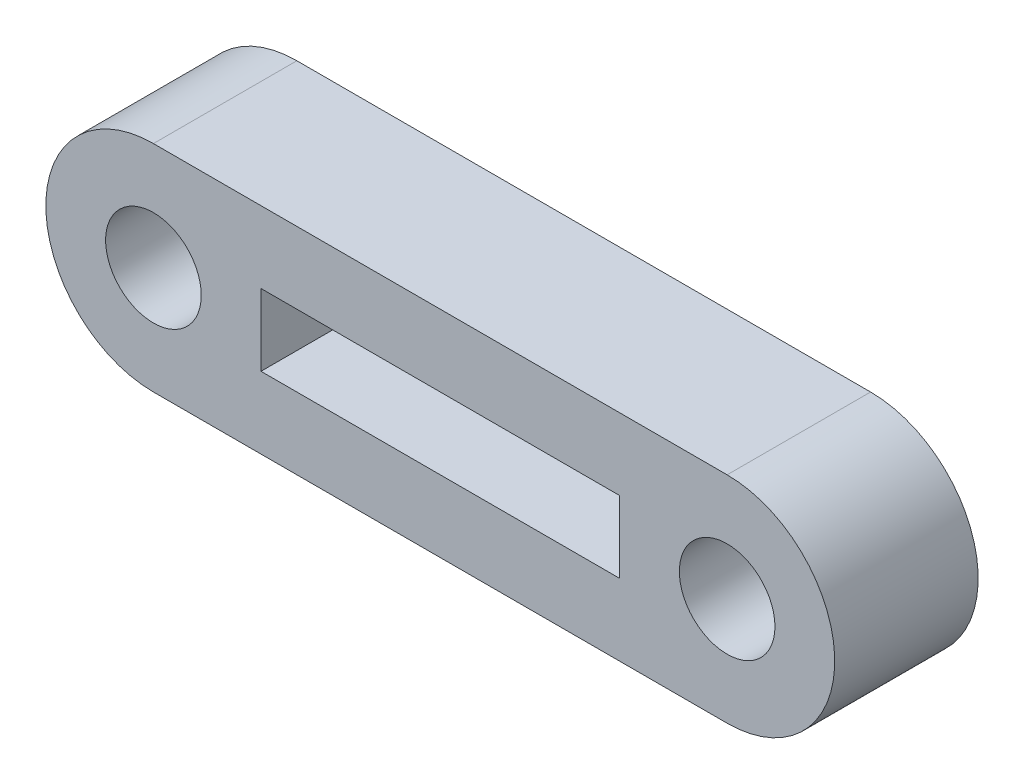
from build123d import *

# Parameters (mm, degrees)
SKETCH1_R           = 2
SKETCH1_W           = 15
SKETCH1_H           = 3
BOSS_EXTRUDE1_DEPTH = 6


with BuildPart() as part:
    # Sketch1 → Boss-Extrude1 (new body)
    with BuildSketch(Plane.XY):
        with BuildLine():
            Line((-12, 4.5), (12, 4.5))
            ThreePointArc((12, 4.5), (16.5, 0), (12, -4.5))
            Line((12, -4.5), (-12, -4.5))
            ThreePointArc((-12, -4.5), (-16.5, 0), (-12, 4.5))
        make_face()
        with Locations((-12, 0)):
            Circle(SKETCH1_R, mode=Mode.SUBTRACT)
        with Locations((12, 0)):
            Circle(SKETCH1_R, mode=Mode.SUBTRACT)
        Rectangle(SKETCH1_W, SKETCH1_H, mode=Mode.SUBTRACT)
    extrude(amount=BOSS_EXTRUDE1_DEPTH)


solid = part.part
